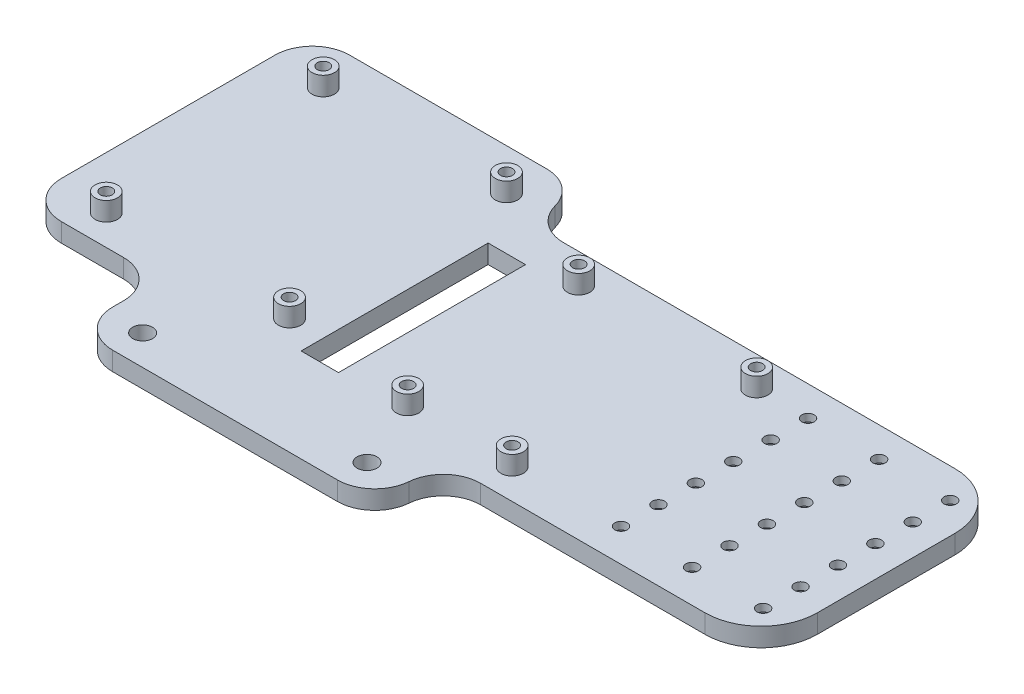
from build123d import *

# Parameters (mm, degrees)
SKETCH1_W             = 270
SKETCH1_H             = 100
BOSS_EXTRUDE1_DEPTH   = 5
SKETCH3_R             = 3
SKETCH3_R_2           = 1.6
BOSS_EXTRUDE2_DEPTH   = 5
CUT_EXTRUDE1_START    = -5
SKETCH4_R             = 1.6
CUT_EXTRUDE1_DEPTH    = 5
SKETCH5_R             = 3.25
CUT_EXTRUDE2_DEPTH    = 3.2
SKETCH6_R             = 1.6
CUT_EXTRUDE3_DEPTH    = 23.2
BOSS_EXTRUDE3_START   = 5
SKETCH7_R             = 3
SKETCH7_R_2           = 1.6
BOSS_EXTRUDE3_DEPTH   = 5
SKETCH8_R             = 3.25
CUT_EXTRUDE4_DEPTH    = 3.2
LPATTERN1_COUNT       = 3
LPATTERN1_PITCH       = 60
SKETCH9_W             = 10
SKETCH9_H             = 50
CUT_EXTRUDE5_DEPTH    = 13.2
SKETCH11_W            = 123.368686451
SKETCH11_H            = 100
CUT_EXTRUDE7_DEPTH    = 10
SKETCH12_R            = 2.65
CUT_EXTRUDE8_DEPTH    = 10
CUT_EXTRUDE9_DEPTH    = 10
FILLET1_R             = 10
FILLET2_R             = 10
BOSS_EXTRUDE4_DEPTH   = 5
SKETCH15_W            = 5
SKETCH15_H            = 1.59084846
BOSS_EXTRUDE5_DEPTH   = 5
F_3_0MM_DOWEL_HOLE2_D = 3.3
LPATTERN2_COUNT       = 3
LPATTERN2_PITCH       = 19
LPATTERN2_COUNT_DIR2  = 6
LPATTERN2_PITCH_DIR2  = 10
CUT_EXTRUDE10_DEPTH   = 3
LPATTERN3_COUNT       = 3
LPATTERN3_PITCH       = 19
LPATTERN3_COUNT_DIR2  = 6
LPATTERN3_PITCH_DIR2  = 10
CUT_EXTRUDE11_DEPTH   = 3
SKETCH21_W            = 10
SKETCH21_H            = 73.328756013
CUT_EXTRUDE12_DEPTH   = 235.121363694
FILLET5_R             = 15


with BuildPart() as part:
    # Sketch1 → Boss-Extrude1 (new body)
    with BuildSketch(Plane(origin=(0, 0, 0), x_dir=(1, 0, 0), z_dir=(0, 1, 0))):
        with Locations((135, 50)):
            Rectangle(SKETCH1_W, SKETCH1_H)
    extrude(amount=BOSS_EXTRUDE1_DEPTH)

    # Sketch3 → Boss-Extrude2 (add)
    # profile 1 of 4: a face of its own
    with BuildSketch(Plane(origin=(0, 5, 0), x_dir=(1, 0, 0), z_dir=(0, 1, 0))):
        with Locations(Location((14.003763212, 88.913523518, 0), (0, 0, 90))):
            Circle(SKETCH3_R)
        with Locations(Location((14.003763212, 88.913523518, 0), (0, 0, 270))):
            Circle(SKETCH3_R_2, mode=Mode.SUBTRACT)
    # profile 2 of 4: a face of its own
    with BuildSketch(Plane(origin=(0, 5, 0), x_dir=(1, 0, 0), z_dir=(0, 1, 0))):
        with Locations(Location((63.003763212, 88.913523518, 0), (0, 0, 90))):
            Circle(SKETCH3_R)
        with Locations(Location((63.003763212, 88.913523518, 0), (0, 0, 270))):
            Circle(SKETCH3_R_2, mode=Mode.SUBTRACT)
    # profile 3 of 4: a face of its own
    with BuildSketch(Plane(origin=(0, 5, 0), x_dir=(1, 0, 0), z_dir=(0, 1, 0))):
        with Locations(Location((63.003763212, 30.913523518, 0), (0, 0, 90))):
            Circle(SKETCH3_R)
        with Locations(Location((63.003763212, 30.913523518, 0), (0, 0, 270))):
            Circle(SKETCH3_R_2, mode=Mode.SUBTRACT)
    # profile 4 of 4: a face of its own
    with BuildSketch(Plane(origin=(0, 5, 0), x_dir=(1, 0, 0), z_dir=(0, 1, 0))):
        with Locations(Location((14.003763212, 30.913523518, 0), (0, 0, 90))):
            Circle(SKETCH3_R)
        with Locations(Location((14.003763212, 30.913523518, 0), (0, 0, 270))):
            Circle(SKETCH3_R_2, mode=Mode.SUBTRACT)
    extrude(amount=BOSS_EXTRUDE2_DEPTH)

    # Sketch4 → Cut-Extrude1 (cut)
    with BuildSketch(Plane(origin=(0, 5, 0), x_dir=(1, 0, 0), z_dir=(0, 1, 0)).offset(CUT_EXTRUDE1_START)):
        with Locations(Location((14.003763212, 88.913523518, 0), (0, 0, 270))):
            Circle(SKETCH4_R)
        with Locations(Location((63.003763212, 88.913523518, 0), (0, 0, 270))):
            Circle(SKETCH4_R)
        with Locations(Location((63.003763212, 30.913523518, 0), (0, 0, 270))):
            Circle(SKETCH4_R)
        with Locations(Location((14.003763212, 30.913523518, 0), (0, 0, 270))):
            Circle(SKETCH4_R)
    extrude(amount=CUT_EXTRUDE1_DEPTH, mode=Mode.SUBTRACT)

    # Sketch5 → Cut-Extrude2 (cut)
    with BuildSketch(Plane(origin=(0, 0, 0), x_dir=(-1, 0, 0), z_dir=(0, -1, 0))):
        with Locations(Location((-63.003763212, 88.913523518, 0), (0, 0, 90))):
            Circle(SKETCH5_R)
        with Locations(Location((-14.003763212, 88.913523518, 0), (0, 0, 90))):
            Circle(SKETCH5_R)
        with Locations(Location((-14.003763212, 30.913523518, 0), (0, 0, 90))):
            Circle(SKETCH5_R)
        with Locations(Location((-63.003763212, 30.913523518, 0), (0, 0, 90))):
            Circle(SKETCH5_R)
    extrude(amount=-CUT_EXTRUDE2_DEPTH, mode=Mode.SUBTRACT)

    # Sketch6 → Cut-Extrude3 (cut)
    with BuildSketch(Plane(origin=(0, 5, 0), x_dir=(1, 0, 0), z_dir=(0, 1, 0))):
        with Locations(Location((141.631313549, 77.173523518, 0), (0, 0, 270))):
            Circle(SKETCH6_R)
        with Locations(Location((94.031313549, 77.173523518, 0), (0, 0, 270))):
            Circle(SKETCH6_R)
        with Locations(Location((99.111313549, 26.373523518, 0), (0, 0, 270))):
            Circle(SKETCH6_R)
        with Locations(Location((127.051313549, 26.373523518, 0), (0, 0, 270))):
            Circle(SKETCH6_R)
        with Locations(Location((154.031313549, 77.173523518, 0), (0, 0, 270))):
            Circle(SKETCH6_R)
        with Locations(Location((159.111313549, 26.373523518, 0), (0, 0, 270))):
            Circle(SKETCH6_R)
        with Locations(Location((187.051313549, 26.373523518, 0), (0, 0, 270))):
            Circle(SKETCH6_R)
        with Locations(Location((201.631313549, 77.173523518, 0), (0, 0, 270))):
            Circle(SKETCH6_R)
        with Locations(Location((214.031313549, 77.173523518, 0), (0, 0, 270))):
            Circle(SKETCH6_R)
        with Locations(Location((219.111313549, 26.373523518, 0), (0, 0, 270))):
            Circle(SKETCH6_R)
        with Locations(Location((247.051313549, 26.373523518, 0), (0, 0, 270))):
            Circle(SKETCH6_R)
        with Locations(Location((261.631313549, 77.173523518, 0), (0, 0, 270))):
            Circle(SKETCH6_R)
    extrude(amount=-CUT_EXTRUDE3_DEPTH, mode=Mode.SUBTRACT)

    # Sketch7 → Boss-Extrude3 (add)
    # profile 1 of 4: a face of its own
    with BuildSketch(Plane(origin=(0, 5, 0), x_dir=(1, 0, 0), z_dir=(0, 1, 0)).offset(BOSS_EXTRUDE3_START)):
        with Locations(Location((94.031313549, 77.173523518, 0), (0, 0, 90))):
            Circle(SKETCH7_R)
        with Locations(Location((94.031313549, 77.173523518, 0), (0, 0, 270))):
            Circle(SKETCH7_R_2, mode=Mode.SUBTRACT)
    # profile 2 of 4: a face of its own
    with BuildSketch(Plane(origin=(0, 5, 0), x_dir=(1, 0, 0), z_dir=(0, 1, 0)).offset(BOSS_EXTRUDE3_START)):
        with Locations(Location((141.631313549, 77.173523518, 0), (0, 0, 90))):
            Circle(SKETCH7_R)
        with Locations(Location((141.631313549, 77.173523518, 0), (0, 0, 270))):
            Circle(SKETCH7_R_2, mode=Mode.SUBTRACT)
    # profile 3 of 4: a face of its own
    with BuildSketch(Plane(origin=(0, 5, 0), x_dir=(1, 0, 0), z_dir=(0, 1, 0)).offset(BOSS_EXTRUDE3_START)):
        with Locations(Location((127.051313549, 26.373523518, 0), (0, 0, 90))):
            Circle(SKETCH7_R)
        with Locations(Location((127.051313549, 26.373523518, 0), (0, 0, 270))):
            Circle(SKETCH7_R_2, mode=Mode.SUBTRACT)
    # profile 4 of 4: a face of its own
    with BuildSketch(Plane(origin=(0, 5, 0), x_dir=(1, 0, 0), z_dir=(0, 1, 0)).offset(BOSS_EXTRUDE3_START)):
        with Locations(Location((99.111313549, 26.373523518, 0), (0, 0, 90))):
            Circle(SKETCH7_R)
        with Locations(Location((99.111313549, 26.373523518, 0), (0, 0, 270))):
            Circle(SKETCH7_R_2, mode=Mode.SUBTRACT)
    boss_extrude3 = extrude(amount=-BOSS_EXTRUDE3_DEPTH)

    # Sketch8 → Cut-Extrude4 (cut)
    with BuildSketch(Plane.XZ):
        with Locations(Location((94.031313549, -77.173523518, 0), (0, 0, 270))):
            Circle(SKETCH8_R)
        with Locations(Location((99.111313549, -26.373523518, 0), (0, 0, 270))):
            Circle(SKETCH8_R)
        with Locations(Location((127.051313549, -26.373523518, 0), (0, 0, 270))):
            Circle(SKETCH8_R)
        with Locations(Location((141.631313549, -77.173523518, 0), (0, 0, 270))):
            Circle(SKETCH8_R)
    cut_extrude4 = extrude(amount=-CUT_EXTRUDE4_DEPTH, mode=Mode.SUBTRACT)

    # LPattern1: Boss-Extrude3, Cut-Extrude4 ×3
    with Locations(*[(i * LPATTERN1_PITCH, 0, 0) for i in range(1, LPATTERN1_COUNT)]):
        add(boss_extrude3)
        add(cut_extrude4, mode=Mode.SUBTRACT)

    # Sketch9 → Cut-Extrude5 (cut)
    with BuildSketch(Plane(origin=(0, 5, 0), x_dir=(1, 0, 0), z_dir=(0, 1, 0))):
        with Locations((77, 50)):
            Rectangle(SKETCH9_W, SKETCH9_H)
    extrude(amount=-CUT_EXTRUDE5_DEPTH, mode=Mode.SUBTRACT)

    # Sketch11 → Cut-Extrude7 (cut)
    with BuildSketch(Plane(origin=(0, 5, 0), x_dir=(1, 0, 0), z_dir=(0, 1, 0))):
        with Locations((208.315656774, 50)):
            Rectangle(SKETCH11_W, SKETCH11_H)
    extrude(amount=-CUT_EXTRUDE7_DEPTH, mode=Mode.SUBTRACT)


with BuildPart() as body_2:
    # of the pieces the cut leaves, the one that is kept (cut_extrude7_keep)
    add(part.part.solids().sort_by_distance((0, 0, 0))[0])

    # Sketch12 → Cut-Extrude8 (cut)
    with BuildSketch(Plane(origin=(0, 5, 0), x_dir=(1, 0, 0), z_dir=(0, 1, 0))):
        with Locations(Location((46.631313549, 8, 0), (0, 0, 270))):
            Circle(SKETCH12_R)
        with Locations(Location((106.631313549, 8, 0), (0, 0, 270))):
            Circle(SKETCH12_R)
    extrude(amount=-CUT_EXTRUDE8_DEPTH, mode=Mode.SUBTRACT)

    # Sketch13 → Cut-Extrude9 (cut)
    with BuildSketch(Plane(origin=(0, 5, 0), x_dir=(1, 0, 0), z_dir=(0, 1, 0))):
        with BuildLine():
            Line((0, 0), (36.631313549, 0))
            Line((36.631313549, 0), (36.631313549, 12.913523518))
            ThreePointArc((36.631313549, 12.913523518), (33.702381361, 19.98459133), (26.631313549, 22.913523518))
            Line((26.631313549, 22.913523518), (10, 22.913523518))
            ThreePointArc((10, 22.913523518), (2.928932188, 25.842455706), (0, 32.913523518))
            Line((0, 32.913523518), (0, 0))
        make_face()
        with BuildLine():
            Line((82, 85.173523518), (141.631313549, 85.173523518))
            ThreePointArc((141.631313549, 85.173523518), (145.166847455, 83.709057424), (146.631313549, 80.173523518))
            Line((146.631313549, 80.173523518), (146.631313549, 100))
            Line((146.631313549, 100), (72, 100))
            Line((72, 100), (72, 95.173523518))
            ThreePointArc((72, 95.173523518), (74.928932188, 88.102455706), (82, 85.173523518))
        make_face()
        with BuildLine():
            Line((146.631313549, 0), (146.631313549, 28.373523518))
            ThreePointArc((146.631313549, 28.373523518), (143.702381361, 21.302455706), (136.631313549, 18.373523518))
            Line((136.631313549, 18.373523518), (126.631313549, 18.373523518))
            ThreePointArc((126.631313549, 18.373523518), (119.560245738, 15.44459133), (116.631313549, 8.373523518))
            Line((116.631313549, 8.373523518), (116.631313549, 0))
            Line((116.631313549, 0), (146.631313549, 0))
        make_face()
    extrude(amount=-CUT_EXTRUDE9_DEPTH, mode=Mode.SUBTRACT)

    # Fillet1
    fillet1_edges = [body_2.edges().sort_by_distance(p)[0] for p in [
        (36.631313549, 2.5, 0),
        (116.631313549, 2.5, 0),
        (72, 2.5, -100),
    ]]
    fillet(fillet1_edges, radius=FILLET1_R)

    # Fillet2
    fillet2_edges = [body_2.edges().sort_by_distance(p)[0] for p in [
        (0, 2.5, -100),
    ]]
    fillet(fillet2_edges, radius=FILLET2_R)

    # Sketch14 → Boss-Extrude4 (add)
    with BuildSketch(Plane(origin=(0, 5, 0), x_dir=(1, 0, 0), z_dir=(0, 1, 0))):
        with BuildLine():
            Line((211.631313549, 85.173523518), (141.631313549, 85.173523518))
            ThreePointArc((141.631313549, 85.173523518), (145.166847455, 83.709057424), (146.631313549, 80.173523518))
            Line((146.631313549, 80.173523518), (146.631313549, 28.373523518))
            ThreePointArc((146.631313549, 28.373523518), (145.291567587, 23.373523518), (141.631313549, 19.71326948))
            Line((141.631313549, 19.71326948), (141.631313549, 18.373523518))
            Line((141.631313549, 18.373523518), (211.631313549, 18.373523518))
            Line((211.631313549, 18.373523518), (211.631313549, 85.173523518))
        make_face()
        with BuildLine():
            Line((141.631313549, 19.71326948), (141.631313549, 27.275792894))
            Line((141.631313549, 27.275792894), (136.631313549, 27.275792894))
            Line((136.631313549, 27.275792894), (136.631313549, 18.373523518))
            ThreePointArc((136.631313549, 18.373523518), (139.219504, 18.714265255), (141.631313549, 19.71326948))
        make_face()
    extrude(amount=-BOSS_EXTRUDE4_DEPTH)

    # Sketch15 → Boss-Extrude5 (add)
    with BuildSketch(Plane(origin=(0, 5, 0), x_dir=(1, 0, 0), z_dir=(0, 1, 0))):
        with Locations((139.131313549, 19.168947748)):
            Rectangle(SKETCH15_W, SKETCH15_H)
    extrude(amount=-BOSS_EXTRUDE5_DEPTH)

    # Ø3.0mm Dowel Hole2 (through all)
    with Locations(Plane(origin=(155.366364465, 5, -77.173523518), x_dir=(0, 0, 1), z_dir=(0, 1, 0))):
        with Locations((0, 0)):
            f_3_0mm_dowel_hole2 = Hole(F_3_0MM_DOWEL_HOLE2_D / 2)

    # LPattern2: 3.0mm Dowel Hole2 3 × 6
    with Locations(*[(i * LPATTERN2_PITCH, 0, j * LPATTERN2_PITCH_DIR2) for i in range(LPATTERN2_COUNT) for j in range(LPATTERN2_COUNT_DIR2) if (i, j) != (0, 0)]):
        add(f_3_0mm_dowel_hole2, mode=Mode.SUBTRACT)

    # Sketch19 → Cut-Extrude10 (cut)
    with BuildSketch(Plane(origin=(0, 0, 0), x_dir=(-1, 0, 0), z_dir=(0, -1, 0))):
        Polygon((-191.605446144, 80.223523518), (-195.127282786, 80.223523518), (-196.888201107, 77.173523518), (-195.127282786, 74.123523518), (-191.605446144, 74.123523518), (-189.844527823, 77.173523518), align=None)
    cut_extrude10 = extrude(amount=-CUT_EXTRUDE10_DEPTH, mode=Mode.SUBTRACT)

    # LPattern3: Cut-Extrude10 3 × 6
    with Locations(*[(-i * LPATTERN3_PITCH, 0, j * LPATTERN3_PITCH_DIR2) for i in range(LPATTERN3_COUNT) for j in range(LPATTERN3_COUNT_DIR2) if (i, j) != (0, 0)]):
        add(cut_extrude10, mode=Mode.SUBTRACT)

    # Sketch20 → Cut-Extrude11 (cut)
    with BuildSketch(Plane(origin=(0, 0, 0), x_dir=(-1, 0, 0), z_dir=(0, -1, 0))):
        Polygon((-138.109476907, 77.173523518), (-139.870395228, 80.223523518), (-143.39223187, 80.223523518), (-145.153150191, 77.173523518), (-143.39223187, 74.123523518), (-139.870395228, 74.123523518), align=None)
        Polygon((-92.270395228, 80.223523518), (-95.79223187, 80.223523518), (-97.553150191, 77.173523518), (-95.79223187, 74.123523518), (-92.270395228, 74.123523518), (-90.509476907, 77.173523518), align=None)
        Polygon((-95.589476907, 26.373523518), (-97.350395228, 29.423523518), (-100.87223187, 29.423523518), (-102.633150191, 26.373523518), (-100.87223187, 23.323523518), (-97.350395228, 23.323523518), align=None)
        Polygon((-123.529476907, 26.373523518), (-125.290395228, 29.423523518), (-128.81223187, 29.423523518), (-130.573150191, 26.373523518), (-128.81223187, 23.323523518), (-125.290395228, 23.323523518), align=None)
    extrude(amount=-CUT_EXTRUDE11_DEPTH, mode=Mode.SUBTRACT)

    # Sketch21 → Cut-Extrude12 (cut, through all)
    with BuildSketch(Plane(origin=(0, 5, 0), x_dir=(1, 0, 0), z_dir=(0, 1, 0))):
        with Locations((206.631313549, 52.870476794)):
            Rectangle(SKETCH21_W, SKETCH21_H)
    extrude(amount=-CUT_EXTRUDE12_DEPTH, mode=Mode.SUBTRACT)

    # Fillet5
    fillet5_edges = [body_2.edges().sort_by_distance(p)[0] for p in [
        (201.631313549, 2.5, -85.173523518),
        (201.631313549, 2.5, -18.373523518),
    ]]
    fillet(fillet5_edges, radius=FILLET5_R)


solid = body_2.part
